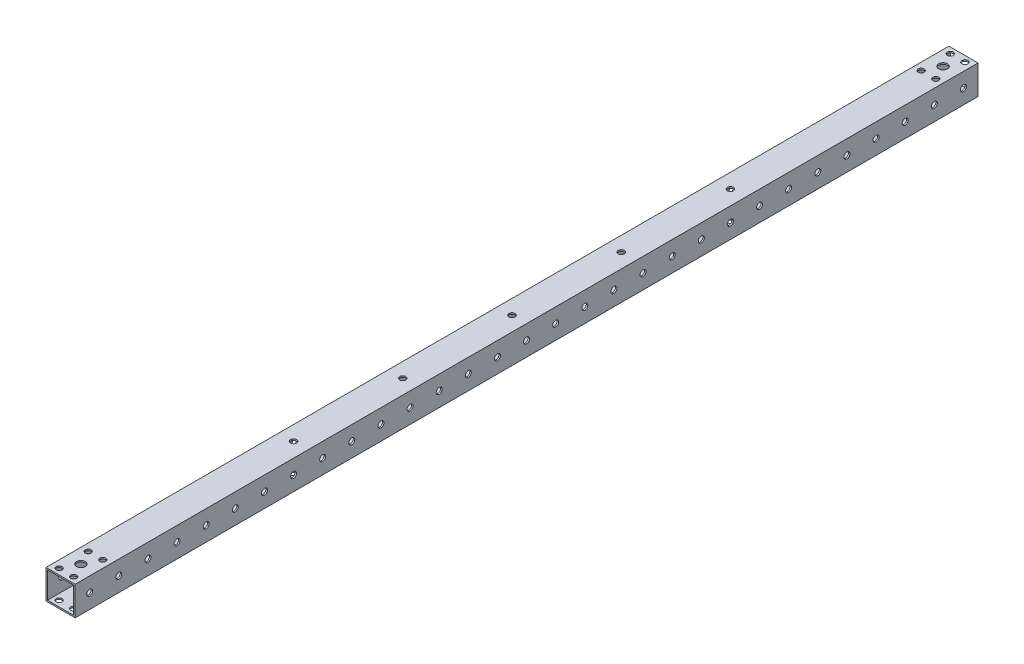
from build123d import *

# Parameters (mm, degrees)
SKETCH_1_W          = 20
SKETCH_1_H          = 20
SKETCH_1_W_2        = 18
SKETCH_1_H_2        = 18
EXTRUDE_1_DEPTH     = 310
SKETCH_2_R          = 2.025
SKETCH_2_R_2        = 3.05
CUT_EXTRUDE_1_DEPTH = 30
SKETCH_3_R          = 2.1
CUT_EXTRUDE_2_DEPTH = 30
SKETCH_4_R          = 2.05
CUT_EXTRUDE_3_DEPTH = 20


with BuildPart() as part:
    # 草图1 → 凸台-拉伸1 (new, symmetric)
    with BuildSketch(Plane.XY):
        Rectangle(SKETCH_1_W, SKETCH_1_H)
        Rectangle(SKETCH_1_W_2, SKETCH_1_H_2, mode=Mode.SUBTRACT)
    extrude(amount=EXTRUDE_1_DEPTH, both=True)

    # 草图2 → 切除-拉伸1 (cut)
    with BuildSketch(Plane(origin=(0, 10, 0), x_dir=(1, 0, 0), z_dir=(0, 1, 0))):
        with Locations(Location((-5, -286, 0), (0, 0, 270))):
            Circle(SKETCH_2_R)
        with Locations(Location((5, -286, 0), (0, 0, 270))):
            Circle(SKETCH_2_R)
        with Locations(Location((-5, -306, 0), (0, 0, 270))):
            Circle(SKETCH_2_R)
        with Locations(Location((5, -306, 0), (0, 0, 270))):
            Circle(SKETCH_2_R)
        with Locations(Location((0, -296, 0), (0, 0, 270))):
            Circle(SKETCH_2_R_2)
        with Locations((5, 306)):
            Circle(SKETCH_2_R)
        with Locations((5, 286)):
            Circle(SKETCH_2_R)
        with Locations((-5, 286)):
            Circle(SKETCH_2_R)
        with Locations((0, 296)):
            Circle(SKETCH_2_R_2)
        with Locations((-5, 306)):
            Circle(SKETCH_2_R)
    extrude(amount=-CUT_EXTRUDE_1_DEPTH, mode=Mode.SUBTRACT)

    # 草图3 → 切除-拉伸2 (cut)
    with BuildSketch(Plane(origin=(0, 10, 0), x_dir=(1, 0, 0), z_dir=(0, 1, 0))):
        with Locations(Location((0, 150, 0), (0, 0, 270))):
            Circle(SKETCH_3_R)
        with Locations(Location((0, 75, 0), (0, 0, 270))):
            Circle(SKETCH_3_R)
        with Locations(Location((0, 0, 0), (0, 0, 270))):
            Circle(SKETCH_3_R)
        with Locations(Location((0, -75, 0), (0, 0, 270))):
            Circle(SKETCH_3_R)
        with Locations(Location((0, -150, 0), (0, 0, 270))):
            Circle(SKETCH_3_R)
    extrude(amount=-CUT_EXTRUDE_2_DEPTH, mode=Mode.SUBTRACT)

    # 草图4 → 切除-拉伸3 (cut, symmetric)
    with BuildSketch(Plane(origin=(10, 0, 0), x_dir=(0, 0, -1), z_dir=(1, 0, 0))):
        with Locations((-300, 0)):
            Circle(SKETCH_4_R)
        with Locations((-280, 0)):
            Circle(SKETCH_4_R)
        with Locations((-260, 0)):
            Circle(SKETCH_4_R)
        with Locations((-240, 0)):
            Circle(SKETCH_4_R)
        with Locations((-220, 0)):
            Circle(SKETCH_4_R)
        with Locations((-200, 0)):
            Circle(SKETCH_4_R)
        with Locations((-180, 0)):
            Circle(SKETCH_4_R)
        with Locations((-160, 0)):
            Circle(SKETCH_4_R)
        with Locations((-140, 0)):
            Circle(SKETCH_4_R)
        with Locations((-120, 0)):
            Circle(SKETCH_4_R)
        with Locations((-100, 0)):
            Circle(SKETCH_4_R)
        with Locations((-80, 0)):
            Circle(SKETCH_4_R)
        with Locations((-60, 0)):
            Circle(SKETCH_4_R)
        with Locations((-40, 0)):
            Circle(SKETCH_4_R)
        with Locations((-20, 0)):
            Circle(SKETCH_4_R)
        Circle(SKETCH_4_R)
        with Locations((20, 0)):
            Circle(SKETCH_4_R)
        with Locations((40, 0)):
            Circle(SKETCH_4_R)
        with Locations((60, 0)):
            Circle(SKETCH_4_R)
        with Locations((80, 0)):
            Circle(SKETCH_4_R)
        with Locations((100, 0)):
            Circle(SKETCH_4_R)
        with Locations((120, 0)):
            Circle(SKETCH_4_R)
        with Locations((140, 0)):
            Circle(SKETCH_4_R)
        with Locations((160, 0)):
            Circle(SKETCH_4_R)
        with Locations((180, 0)):
            Circle(SKETCH_4_R)
        with Locations((200, 0)):
            Circle(SKETCH_4_R)
        with Locations((220, 0)):
            Circle(SKETCH_4_R)
        with Locations((240, 0)):
            Circle(SKETCH_4_R)
        with Locations((260, 0)):
            Circle(SKETCH_4_R)
        with Locations((280, 0)):
            Circle(SKETCH_4_R)
        with Locations((300, 0)):
            Circle(SKETCH_4_R)
    extrude(amount=CUT_EXTRUDE_3_DEPTH, both=True, mode=Mode.SUBTRACT)


solid = part.part
